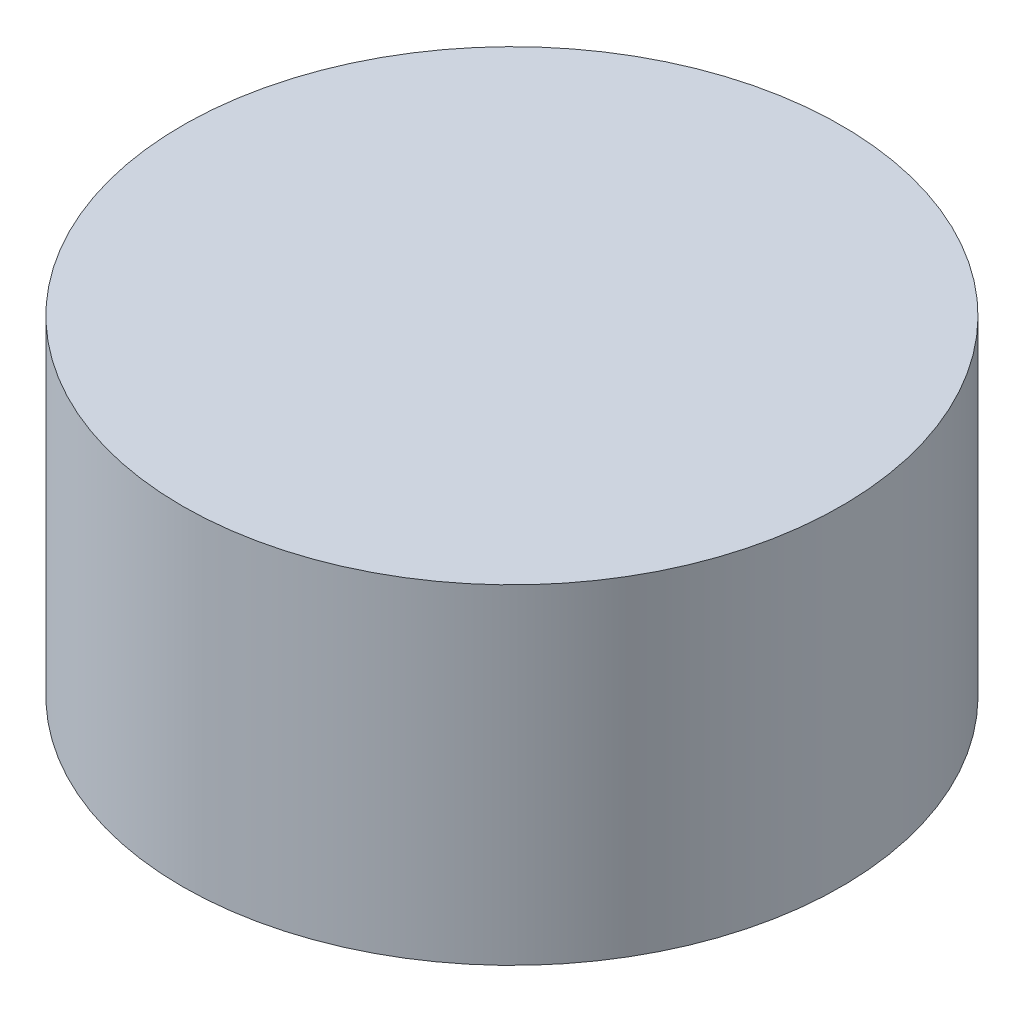
from build123d import *

# Parameters (mm, degrees)
SKETCH1_R           = 10
SKETCH1_R_2         = 3
BOSS_EXTRUDE1_DEPTH = 10
BOSS_EXTRUDE2_START = -10
SKETCH2_R           = 3
BOSS_EXTRUDE2_DEPTH = 10


with BuildPart() as part:
    # Sketch1 → Boss-Extrude1 (new body)
    with BuildSketch(Plane(origin=(0, 0, 0), x_dir=(1, 0, 0), z_dir=(0, 1, 0))):
        with Locations(Location((0, 0, 0), (0, 0, 270))):
            Circle(SKETCH1_R)
        with Locations(Location((0, 0, 0), (0, 0, 270))):
            Circle(SKETCH1_R_2, mode=Mode.SUBTRACT)
    extrude(amount=BOSS_EXTRUDE1_DEPTH)

    # Sketch2 → Boss-Extrude2 (add)
    with BuildSketch(Plane(origin=(0, 10, 0), x_dir=(1, 0, 0), z_dir=(0, 1, 0)).offset(BOSS_EXTRUDE2_START)):
        Circle(SKETCH2_R)
    extrude(amount=BOSS_EXTRUDE2_DEPTH)


solid = part.part
